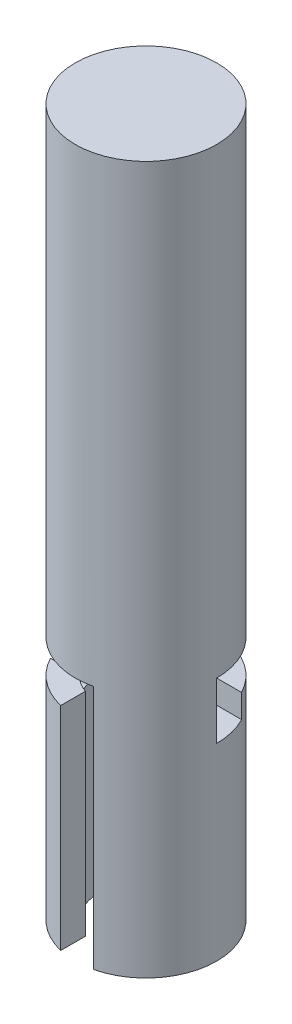
from build123d import *

# Parameters (mm, degrees)
SKETCH1_R           = 15
BOSS_EXTRUDE1_DEPTH = 75
CUT_EXTRUDE1_DEPTH  = 52
CUT_EXTRUDE2_DEPTH  = 3.5
SKETCH9_R           = 10
CUT_EXTRUDE12_DEPTH = 70
SKETCH17_W          = 7
SKETCH17_H          = 12
CUT_EXTRUDE19_DEPTH = 15
SKETCH19_W          = 7
SKETCH19_H          = 12
CUT_EXTRUDE20_DEPTH = 15


with BuildPart() as part:
    # Sketch1 → Boss-Extrude1 (new, symmetric)
    with BuildSketch(Plane(origin=(0, 0, 0), x_dir=(1, 0, 0), z_dir=(0, 1, 0))):
        with Locations(Location((0, 0, 0), (0, 0, 270))):
            Circle(SKETCH1_R)
    extrude(amount=BOSS_EXTRUDE1_DEPTH, both=True)

    # Sketch2 → Cut-Extrude1 (cut)
    with BuildSketch(Plane.XZ.offset(75)):
        with BuildLine():
            Line((3.5, 15), (3.5, -15))
            ThreePointArc((3.5, -15), (0, -18.5), (-3.5, -15))
            Line((-3.5, -15), (-3.5, 15))
            ThreePointArc((-3.5, 15), (0, 18.5), (3.5, 15))
        make_face()
    extrude(amount=-CUT_EXTRUDE1_DEPTH, mode=Mode.SUBTRACT)

    # Sketch3 → Cut-Extrude2 (cut, symmetric)
    with BuildSketch(Plane(origin=(0, -26.5, 0), x_dir=(1, 0, 0), z_dir=(0, 1, 0))):
        Polygon((-14.980069936, 0), (-15.328117643, -9.993941304), (-0.348047707, -16.993941304), (0, -7), align=None)
        Polygon((15, 0), (0, 7), (0.348047707, 16.993941304), (15.348047707, 9.993941304), align=None)
    extrude(amount=CUT_EXTRUDE2_DEPTH, both=True, mode=Mode.SUBTRACT)

    # Sketch9 → Cut-Extrude12 (cut)
    with BuildSketch(Plane.XZ.offset(75)):
        with Locations(Location((0, 0, 0), (0, 0, 270))):
            Circle(SKETCH9_R)
    extrude(amount=-CUT_EXTRUDE12_DEPTH, mode=Mode.SUBTRACT)

    # Sketch17 → Cut-Extrude19 (cut)
    with BuildSketch(Plane(origin=(15, 0, 0), x_dir=(0, 0, -1), z_dir=(1, 0, 0))):
        with Locations((3.5, -29)):
            Rectangle(SKETCH17_W, SKETCH17_H)
    extrude(amount=-CUT_EXTRUDE19_DEPTH, mode=Mode.SUBTRACT)

    # Sketch19 → Cut-Extrude20 (cut)
    with BuildSketch(Plane.ZY.offset(15)):
        with Locations((3.5, -29)):
            Rectangle(SKETCH19_W, SKETCH19_H)
    extrude(amount=-CUT_EXTRUDE20_DEPTH, mode=Mode.SUBTRACT)


solid = part.part
